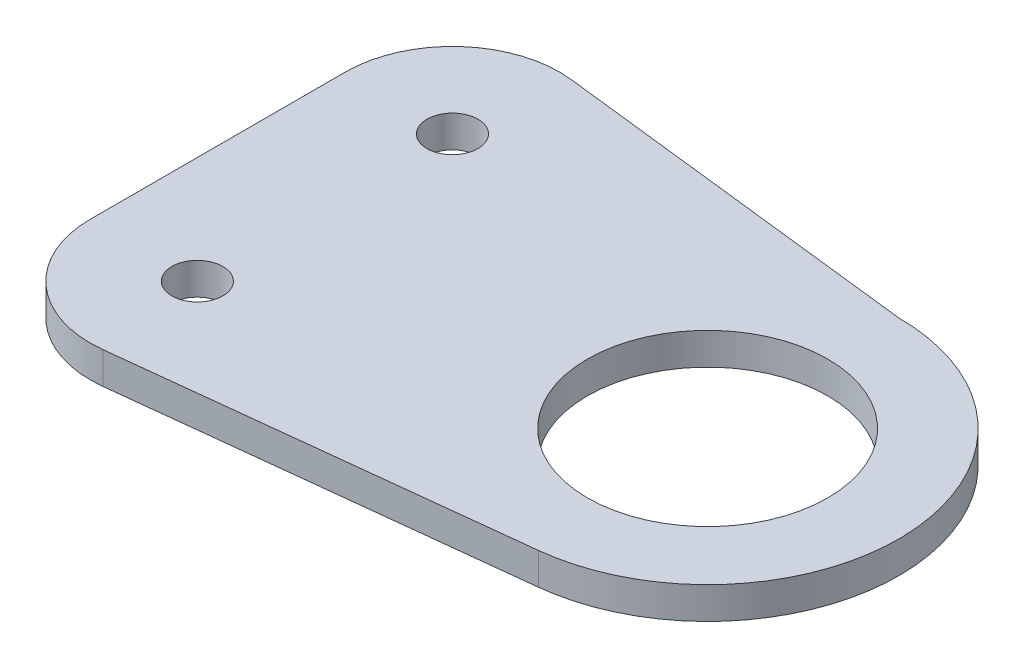
from build123d import *

# Parameters (mm, degrees)
SKETCH1_R           = 11.96975
SKETCH1_R_2         = 2.54
BOSS_EXTRUDE1_DEPTH = 3.175


with BuildPart() as part:
    # Sketch1 → Boss-Extrude1 (new body)
    with BuildSketch(Plane(origin=(0, 0, 0), x_dir=(1, 0, 0), z_dir=(0, 1, 0))):
        with BuildLine():
            Line((-48.768, 12.7), (-48.768, -12.7))
            ThreePointArc((-48.768, -12.7), (-45.211389776, -20.652003487), (-36.913039472, -23.301761585))
            Line((-36.913039472, -23.301761585), (2.119572372, -18.931717116))
            ThreePointArc((2.119572372, -18.931717116), (19.020406292, 1.061435099), (0, 19.05))
            Line((0, 19.05), (-36.87928127, 23.297927617))
            ThreePointArc((-36.87928127, 23.297927617), (-45.198718074, 20.663317506), (-48.768, 12.7))
        make_face()
        with Locations(Location((0, 0, 0), (0, 0, 270))):
            Circle(SKETCH1_R, mode=Mode.SUBTRACT)
        with Locations(Location((-38.1, 12.7, 0), (0, 0, 270))):
            Circle(SKETCH1_R_2, mode=Mode.SUBTRACT)
        with Locations(Location((-38.1, -12.7, 0), (0, 0, 270))):
            Circle(SKETCH1_R_2, mode=Mode.SUBTRACT)
    extrude(amount=BOSS_EXTRUDE1_DEPTH)


solid = part.part
